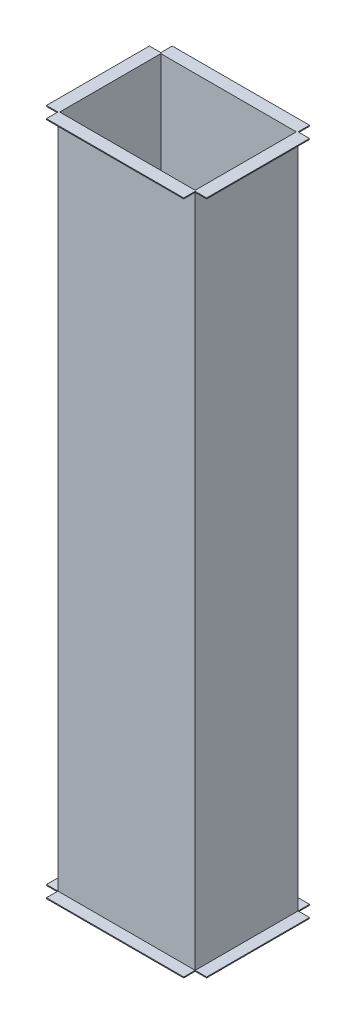
from build123d import *

# Parameters (mm, degrees)
CROQUIS1_W              = 304.8
CROQUIS1_H              = 228.6
SALIENTE_EXTRUIR1_DEPTH = 1500
VACIADO1_T              = -2
CROQUIS2_W              = 25.4
CROQUIS2_H              = 228.6
CROQUIS2_W_2            = 304.8
CROQUIS2_H_2            = 25.4
SALIENTE_EXTRUIR2_DEPTH = 2


with BuildPart() as part:
    # Croquis1 → Saliente-Extruir1 (new body)
    with BuildSketch(Plane(origin=(0, 0, 0), x_dir=(1, 0, 0), z_dir=(0, 1, 0))):
        Rectangle(CROQUIS1_W, CROQUIS1_H)
    extrude(amount=SALIENTE_EXTRUIR1_DEPTH)

    # Vaciado1
    vaciado1_openings = [part.faces().sort_by_distance(p)[0] for p in [
        (0, 1500, 0),
        (0, 0, 0),
    ]]
    offset(amount=VACIADO1_T, openings=vaciado1_openings, kind=Kind.INTERSECTION)

    # Croquis2 → Saliente-Extruir2 (add)
    with BuildSketch(Plane(origin=(0, 1500, 0), x_dir=(1, 0, 0), z_dir=(0, 1, 0))):
        with Locations((-165.1, 0)):
            Rectangle(CROQUIS2_W, CROQUIS2_H)
        with Locations((0, 127)):
            Rectangle(CROQUIS2_W_2, CROQUIS2_H_2)
        with Locations((0, -127)):
            Rectangle(CROQUIS2_W_2, CROQUIS2_H_2)
        with Locations((165.1, 0)):
            Rectangle(CROQUIS2_W, CROQUIS2_H)
    saliente_extruir2 = extrude(amount=-SALIENTE_EXTRUIR2_DEPTH)

    # Simetría1: Saliente-Extruir2 across plane
    add(saliente_extruir2.mirror(Plane.ZX.offset(750)))


solid = part.part
